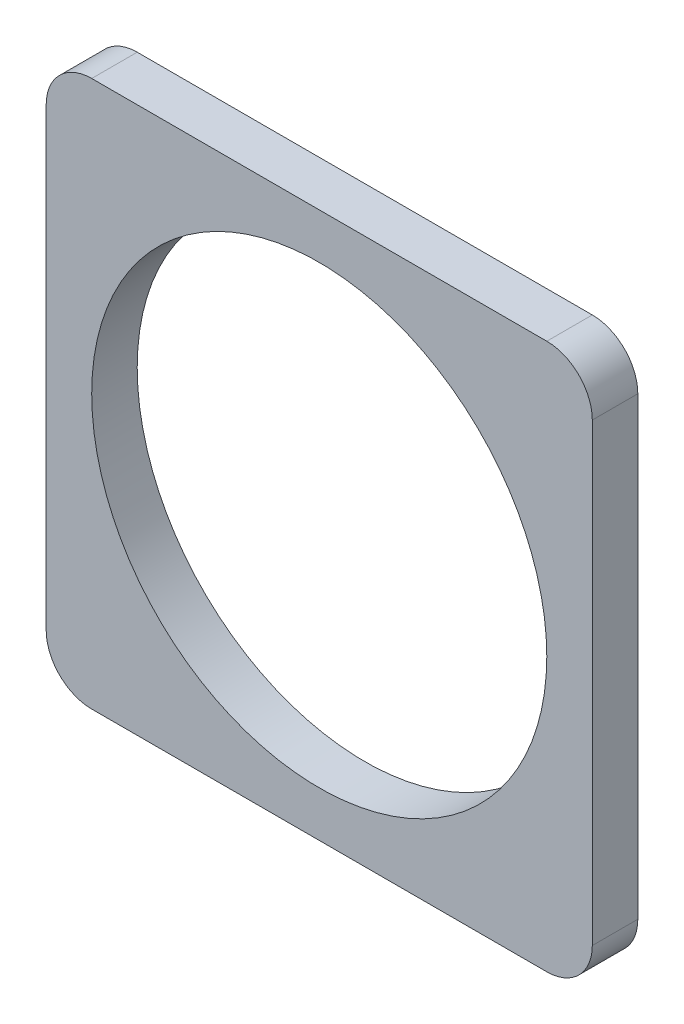
from build123d import *

# Parameters (mm, degrees)
BOSS_EXTRUDE1_DEPTH = 10
SKETCH3_R           = 50
CUT_EXTRUDE2_DEPTH  = 10


with BuildPart() as part:
    # Sketch1 → Boss-Extrude1 (new body)
    with BuildSketch(Plane.XY):
        with BuildLine():
            Line((-50, 60), (50, 60))
            ThreePointArc((50, 60), (57.071067812, 57.071067812), (60, 50))
            Line((60, 50), (60, -50))
            ThreePointArc((60, -50), (57.071067812, -57.071067812), (50, -60))
            Line((50, -60), (-50, -60))
            ThreePointArc((-50, -60), (-57.071067812, -57.071067812), (-60, -50))
            Line((-60, -50), (-60, 50))
            ThreePointArc((-60, 50), (-57.071067812, 57.071067812), (-50, 60))
        make_face()
    extrude(amount=BOSS_EXTRUDE1_DEPTH)

    # Sketch3 → Cut-Extrude2 (cut)
    with BuildSketch(Plane.XY.offset(10)):
        Circle(SKETCH3_R)
    extrude(amount=-CUT_EXTRUDE2_DEPTH, mode=Mode.SUBTRACT)


solid = part.part
